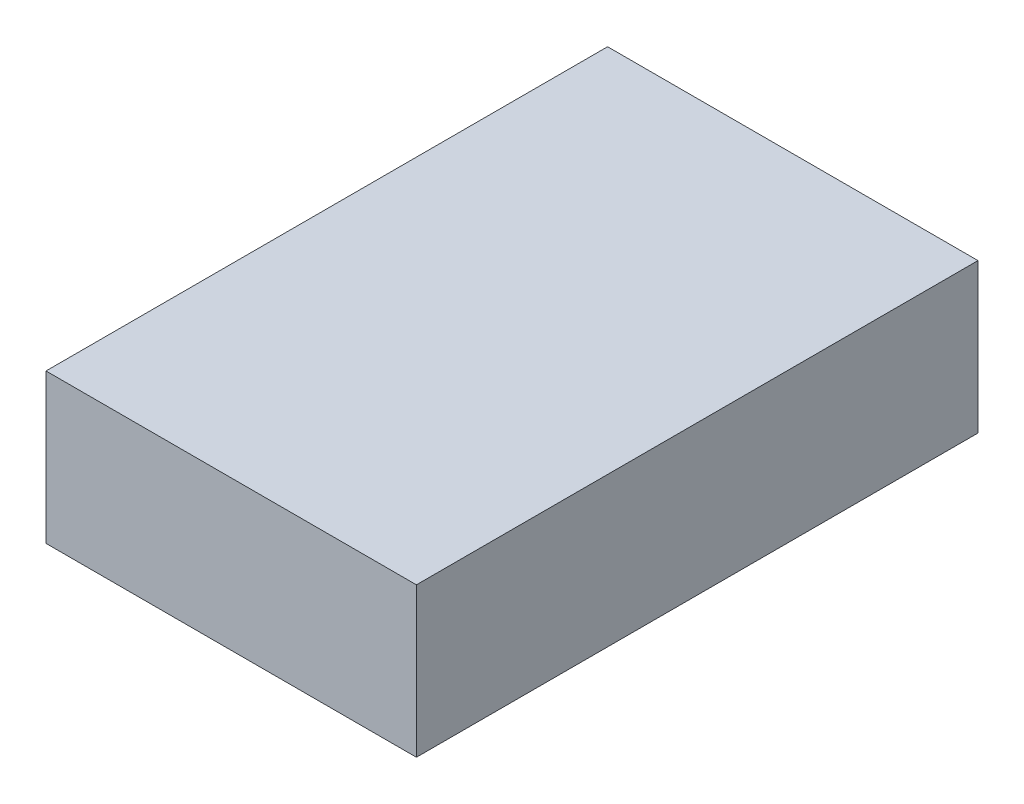
from build123d import *

# Parameters (mm, degrees)
SKETCH1_W           = 62
SKETCH1_H           = 94
BOSS_EXTRUDE1_DEPTH = 25


with BuildPart() as part:
    # Sketch1 → Boss-Extrude1 (new body)
    with BuildSketch(Plane(origin=(0, 0, 0), x_dir=(1, 0, 0), z_dir=(0, 1, 0))):
        Rectangle(SKETCH1_W, SKETCH1_H)
    extrude(amount=BOSS_EXTRUDE1_DEPTH)


solid = part.part
